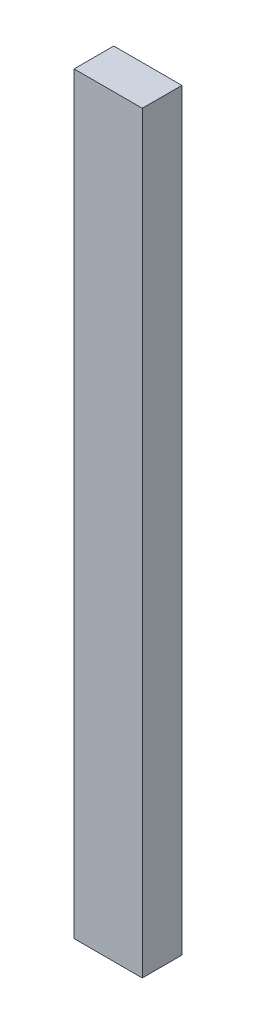
from build123d import *

# Parameters (mm, degrees)
SKETCH1_W           = 25.4
SKETCH1_H           = 25.4
BOSS_EXTRUDE1_DEPTH = 482.6
SKETCH2_R           = 6.35
BOSS_EXTRUDE2_DEPTH = 6.35
SKETCH3_W           = 25.4
SKETCH3_H           = 482.6
BOSS_EXTRUDE3_DEPTH = 18.288


with BuildPart() as part:
    # Sketch1 → Boss-Extrude1 (new body)
    with BuildSketch(Plane(origin=(0, 0, 0), x_dir=(1, 0, 0), z_dir=(0, 1, 0))):
        with Locations((12.7, 12.7)):
            Rectangle(SKETCH1_W, SKETCH1_H)
    extrude(amount=BOSS_EXTRUDE1_DEPTH)

    # Sketch2 → Boss-Extrude2 (add)
    with BuildSketch(Plane(origin=(0, 0, -25.4), x_dir=(-1, 0, 0), z_dir=(0, 0, -1))):
        with Locations(Location((-12.7, 469.9, 0), (0, 0, 180))):
            Circle(SKETCH2_R)
    extrude(amount=BOSS_EXTRUDE2_DEPTH)

    # Sketch3 → Boss-Extrude3 (add)
    with BuildSketch(Plane.ZY):
        with Locations((-12.7, 241.3)):
            Rectangle(SKETCH3_W, SKETCH3_H)
    extrude(amount=BOSS_EXTRUDE3_DEPTH)


solid = part.part
